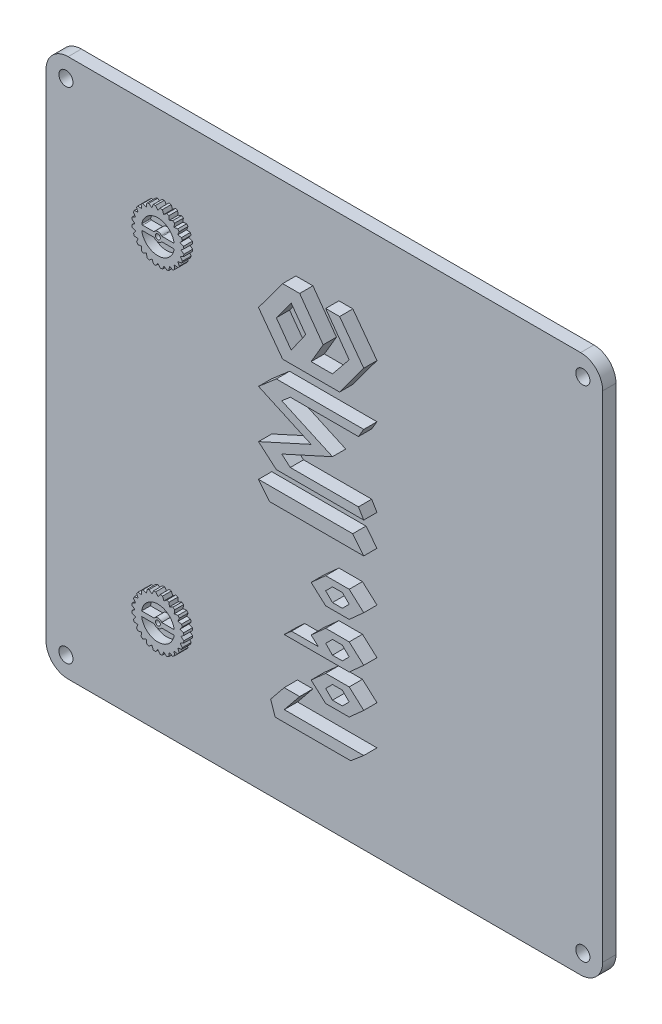
from build123d import *

# Parameters (mm, degrees)
SKETCH1_W                = 126
SKETCH1_H                = 122
BOSS_EXTRUDE1_DEPTH      = 3
RESSALTO_EXTRUS_O3_DEPTH = 3
ESBO_O10_R               = 0.554459351
RESSALTO_EXTRUS_O4_DEPTH = 2
FILETE8_R                = 0.2
FILETE9_R                = 0.2
SKETCH2_R                = 1.6
CUT_EXTRUDE1_DEPTH       = 3
LPATTERN1_COUNT          = 2
LPATTERN1_PITCH          = 113
LPATTERN1_COUNT_DIR2     = 2
LPATTERN1_PITCH_DIR2     = 117
FILLET1_R                = 5
CUT_EXTRUDE2_DEPTH       = 2


with BuildPart() as part:
    # Sketch1 → Boss-Extrude1 (new body)
    with BuildSketch(Plane.XY):
        Rectangle(SKETCH1_W, SKETCH1_H)
    extrude(amount=BOSS_EXTRUDE1_DEPTH)

    # Esboço8 → Ressalto-extrusão3 (add)
    # profile 1 of 8: a face of its own
    with BuildSketch(Plane.XY.offset(3)):
        Polygon((11.907929172, -39.523854918), (8.955209975, -42.023854918), (-8.14458362, -42.023854918), (-9.164277382, -39.013699925), (-6.094843238, -35.222662578), (-2.594843238, -35.222662578), (-6.077327165, -39.523854918), align=None)
    # profile 2 of 8: a face of its own
    with BuildSketch(Plane.XY.offset(3)):
        Polygon((8.616536491, -30.680606308), (11.907929172, -30.680606308), (8.616536491, -27.72682163), (3.291392681, -27.72682163), (0, -30.680606308), (3.291392681, -30.680606308), (4.833551221, -29.138447768), (7.074377951, -29.138447768), align=None)
    # profile 3 of 8: a face of its own
    with BuildSketch(Plane.XY.offset(3)):
        Polygon((8.616536491, -33.634390986), (11.907929172, -30.680606308), (8.616536491, -30.680606308), (7.074377951, -32.222764848), (4.833551221, -32.222764848), (3.291392681, -30.680606308), (0, -30.680606308), (3.291392681, -33.634390986), align=None)
    # profile 4 of 8: a face of its own
    with BuildSketch(Plane.XY.offset(3)):
        Polygon((-4.431630824, -23.327890267), (1.64569634, -23.327890267), (0, -21.850997928), (3.291392681, -18.897213251), (8.616536491, -18.897213251), (11.907929172, -21.850997928), (8.616536491, -24.804782606), (3.291392681, -24.804782606), (-6.077327165, -24.804782606), align=None)
        Polygon((3.291392681, -21.850997928), (4.833551221, -23.393156469), (7.074377951, -23.393156469), (8.616536491, -21.850997928), (7.074377951, -20.308839388), (4.833551221, -20.308839388), align=None, mode=Mode.SUBTRACT)
    # profile 5 of 8: a face of its own
    with BuildSketch(Plane.XY.offset(3)):
        Polygon((3.291392681, -8.586159206), (0, -11.539943884), (3.291392681, -14.493728561), (8.616536491, -14.493728561), (11.907929172, -11.539943884), (8.616536491, -8.586159206), align=None)
        Polygon((4.833551221, -13.082102424), (7.074377951, -13.082102424), (8.616536491, -11.539943884), (7.074377951, -9.997785343), (4.833551221, -9.997785343), (3.291392681, -11.539943884), align=None, mode=Mode.SUBTRACT)
    # profile 6 of 8: a face of its own
    with BuildSketch(Plane.XY.offset(3)):
        Polygon((-11.907929172, 2.701519282), (9.415641061, 2.701519282), (11.907929172, -0.411671336), (-9.409098231, -0.411671336), align=None)
    # profile 7 of 8: a face of its own
    with BuildSketch(Plane.XY.offset(3)):
        Polygon((-7.876504706, 24.396105607), (-11.907929172, 20.921460839), (0, 15.509215469), (-11.907929172, 10.096970098), (-7.876504706, 6.622325331), (11.907929172, 6.622325331), (10.712421474, 8.622325331), (-4.713821815, 8.622325331), (-6.649054262, 10.290282985), (4.833551221, 15.509215469), (-6.649054262, 20.728147953), (-4.713821815, 22.396105607), (10.712421474, 22.396105607), (11.907929172, 24.396105607), align=None)
    # profile 8 of 8: a face of its own
    with BuildSketch(Plane.XY.offset(3)):
        Polygon((2.730300572, 36.388427661), (0, 31.725610755), (4.821452692, 31.725610755), (8.616536491, 36.388427661), (3.291392681, 43.791032685), (6.447947083, 43.791032685), (11.907929172, 36.388427661), (6.447947083, 28.985822638), (-6.447947083, 28.985822638), (-11.907929172, 36.388427661), (-6.447947083, 43.791032685), (-2.594843238, 43.791032685), align=None)
        Polygon((-7.876504706, 36.388427661), (-4.510334397, 31.725610755), (-1.227294144, 36.388427661), (-4.510334397, 40.95225751), align=None, mode=Mode.SUBTRACT)
    extrude(amount=RESSALTO_EXTRUS_O3_DEPTH)

    # Esboço10 → Ressalto-extrusão4 (add)
    with BuildSketch(Plane.XY.offset(3)):
        Polygon((-29.873680548, 38.901444858), (-30.66276966, 39.224397532), (-30.146590041, 39.903012781), (-30.341659693, 40.368382115), (-31.187447548, 40.476099153), (-30.864494874, 41.265188264), (-31.173364136, 41.664212782), (-32.018211689, 41.549353446), (-31.910494651, 42.3951413), (-32.312114592, 42.70062814), (-33.098446879, 42.371019904), (-33.213306215, 43.215867457), (-33.680307101, 43.406998195), (-34.354536876, 42.885103316), (-34.684145112, 43.671435603), (-35.184701604, 43.735184996), (-35.700881222, 43.056569747), (-36.222776102, 43.730799522), (-36.722776102, 43.662823154), (-37.045728775, 42.873734043), (-37.724344024, 43.389913661), (-38.189713359, 43.194844009), (-38.297430396, 42.349056155), (-39.086519507, 42.672008828), (-39.485544025, 42.363139566), (-39.370684689, 41.518292014), (-40.216472543, 41.626009051), (-40.521959383, 41.22438911), (-40.192351147, 40.438056823), (-41.0371987, 40.323197487), (-41.228329439, 39.856196601), (-40.706434559, 39.181966826), (-41.492766846, 38.85235859), (-41.556516239, 38.351802098), (-40.87790099, 37.83562248), (-41.552130765, 37.313727601), (-41.484154397, 36.813727601), (-40.695065286, 36.490774927), (-41.211244904, 35.812159678), (-41.016175252, 35.346790343), (-40.170387398, 35.239073306), (-40.493340071, 34.449984195), (-40.18447081, 34.050959677), (-39.339623257, 34.165819013), (-39.447340295, 33.320031159), (-39.045720353, 33.014544319), (-38.259388066, 33.344152555), (-38.14452873, 32.499305002), (-37.677527844, 32.308174264), (-37.003298069, 32.830069143), (-36.673689833, 32.043736856), (-36.173133341, 31.979987463), (-35.656953723, 32.658602712), (-35.135058844, 31.984372937), (-34.635058844, 32.052349305), (-34.31210617, 32.841438416), (-33.633490921, 32.325258798), (-33.168121587, 32.52032845), (-33.060404549, 33.366116304), (-32.271315438, 33.043163631), (-31.87229092, 33.352032892), (-31.987150256, 34.196880445), (-31.141362402, 34.089163408), (-30.835875562, 34.490783349), (-31.165483798, 35.277115636), (-30.320636245, 35.391974972), (-30.129505507, 35.858975858), (-30.651400386, 36.533205633), (-29.865068099, 36.862813869), (-29.801318706, 37.363370361), (-30.479933955, 37.879549979), (-29.80570418, 38.401444858), align=None)
        with BuildLine():
            Line((-31.996327712, 38.401444858), (-34.824495631, 38.401444858))
            ThreePointArc((-34.824495631, 38.401444858), (-35.678917473, 38.870413407), (-36.533339314, 38.401444858))
            Line((-36.533339314, 38.401444858), (-39.361507234, 38.401444858))
            ThreePointArc((-39.361507234, 38.401444858), (-35.678917473, 41.58011891), (-31.996327712, 38.401444858))
        make_face(mode=Mode.SUBTRACT)
        with BuildLine():
            ThreePointArc((-36.533339314, 37.313727601), (-35.678917473, 36.844759052), (-34.824495631, 37.313727601))
            Line((-34.824495631, 37.313727601), (-31.996327712, 37.313727601))
            ThreePointArc((-31.996327712, 37.313727601), (-35.678917473, 34.135053549), (-39.361507234, 37.313727601))
            Line((-39.361507234, 37.313727601), (-36.533339314, 37.313727601))
        make_face(mode=Mode.SUBTRACT)
        with Locations((-35.678917473, 37.857586229)):
            Circle(ESBO_O10_R, mode=Mode.SUBTRACT)
    ressalto_extrus_o4 = extrude(amount=RESSALTO_EXTRUS_O4_DEPTH)

    # Filete8
    filete8_edges = [part.edges().sort_by_distance(p)[0] for p in [
        (-39.361507234, 38.401444858, 4),
        (-31.996327712, 38.401444858, 4),
        (-39.361507234, 37.313727601, 4),
        (-31.996327712, 37.313727601, 4),
    ]]
    fillet(filete8_edges, radius=FILETE8_R)

    # Filete9
    filete9_edges = [part.edges().sort_by_distance(p)[0] for p in [
        (-34.824495631, 38.401444858, 4),
        (-36.533339314, 37.313727601, 4),
        (-34.824495631, 37.313727601, 4),
        (-36.533339314, 38.401444858, 4),
    ]]
    fillet(filete9_edges, radius=FILETE9_R)

    # Sketch2 → Cut-Extrude1 (cut)
    with BuildSketch(Plane.XY.offset(3)):
        with Locations((-58.5, -56.5)):
            Circle(SKETCH2_R)
    cut_extrude1 = extrude(amount=-CUT_EXTRUDE1_DEPTH, mode=Mode.SUBTRACT)

    # LPattern1: Cut-Extrude1 2 × 2
    with Locations(*[(j * LPATTERN1_PITCH_DIR2, i * LPATTERN1_PITCH, 0) for i in range(LPATTERN1_COUNT) for j in range(LPATTERN1_COUNT_DIR2) if (i, j) != (0, 0)]):
        add(cut_extrude1, mode=Mode.SUBTRACT)

    # Fillet1
    fillet1_edges = [part.edges().sort_by_distance(p)[0] for p in [
        (-63, 61, 1.5),
        (63, 61, 1.5),
        (63, -61, 1.5),
        (-63, -61, 1.5),
    ]]
    fillet(fillet1_edges, radius=FILLET1_R)

    # Mirror1: Ressalto-extrusão4 across plane
    add(ressalto_extrus_o4.mirror(Plane.ZX))

    # Sketch3 → Cut-Extrude2 (cut)
    with BuildSketch(Plane(origin=(0, 0, 0), x_dir=(-1, 0, 0), z_dir=(0, 0, -1))):
        with BuildLine():
            Line((-53.418329696, 46.633705222), (-56.196107474, 46.633705222))
            Line((-56.196107474, 46.633705222), (-56.196107474, 47.605927445))
            Line((-56.196107474, 47.605927445), (-58.834996363, 47.605927445))
            Line((-58.834996363, 47.605927445), (-58.834996363, 50.522594111))
            Line((-58.834996363, 50.522594111), (-52.535083168, 50.522594111))
            add(Edge.make_bspline(
                [(-52.535083168, 50.522594111), (-52.394592355, 50.519232686), (-52.118493509, 50.512626662), (-51.714056273, 50.461448478), (-51.32784645, 50.380168082), (-50.9605981, 50.262294704), (-50.613169102, 50.109481963), (-50.282316499, 49.926417261), (-49.970700174, 49.70858536), (-49.682496439, 49.457240873), (-49.418355854, 49.183708148), (-49.186561329, 48.890018698), (-48.992403169, 48.577336205), (-48.832962338, 48.247862002), (-48.708920895, 47.900758527), (-48.619639748, 47.536597006), (-48.566866004, 47.154646352), (-48.560473105, 46.89428771), (-48.557218585, 46.761743417)],
                knots=[0, 0, 0, 0, 1.100541633, 2.162833772, 3.188943725, 4.189162737, 5.179049965, 6.158447226, 7.147506497, 8.152084341, 9.150261645, 10.123142245, 11.077839049, 12.028489082, 12.985874232, 13.960552905, 14.9617511, 16, 16, 16, 16], degree=3))
            add(Edge.make_bspline(
                [(-48.557218585, 46.761743417), (-48.561456461, 46.615285775), (-48.569820298, 46.326238228), (-48.646734425, 45.903064407), (-48.767395024, 45.497871196), (-48.941611245, 45.113071489), (-49.162592518, 44.746246944), (-49.431526656, 44.397249521), (-49.750531853, 44.066800265), (-49.993084118, 43.870071927), (-50.117548446, 43.769121889)],
                knots=[0, 0, 0, 0, 1.002273698, 1.978078779, 2.935716481, 3.891506896, 4.862685101, 5.86255585, 6.903182576, 8, 8, 8, 8], degree=3))
            Line((-50.117548446, 43.769121889), (-51.855829696, 46.208358))
            add(Edge.make_bspline(
                [(-51.855829696, 46.208358), (-51.814859922, 46.226228326), (-51.735765144, 46.260728138), (-51.62877633, 46.325811707), (-51.537738547, 46.400702343), (-51.462418519, 46.485758614), (-51.406234198, 46.582995126), (-51.364000999, 46.687996626), (-51.340081579, 46.803368086), (-51.336731824, 46.883163134), (-51.334996363, 46.924503833)],
                knots=[0, 0, 0, 0, 1.129705365, 2.180968675, 3.155550737, 4.102251944, 5.037389139, 5.981966108, 6.954484831, 8, 8, 8, 8], degree=3))
            add(Edge.make_bspline(
                [(-51.334996363, 46.924503833), (-51.336662991, 46.978422238), (-51.339813418, 47.080344203), (-51.385852524, 47.221827708), (-51.456557374, 47.342232212), (-51.554571484, 47.444099025), (-51.685468809, 47.517512888), (-51.841953653, 47.567879209), (-52.02446516, 47.601021643), (-52.155145963, 47.604222502), (-52.224753307, 47.605927445)],
                knots=[0, 0, 0, 0, 1.008906688, 1.907136405, 2.76012752, 3.615388814, 4.529008848, 5.54747971, 6.693661033, 8, 8, 8, 8], degree=3))
            Line((-52.224753307, 47.605927445), (-53.418329696, 47.605927445))
            Line((-53.418329696, 47.605927445), (-53.418329696, 46.633705222))
        make_face()
        with BuildLine():
            Line((-51.402270668, 39.272594111), (-54.353659557, 39.272594111))
            add(Edge.make_bspline(
                [(-54.353659557, 39.272594111), (-54.324235867, 39.361499724), (-54.269088883, 39.528129962), (-54.257205861, 39.703121935), (-54.251663029, 39.784746889)],
                knots=[0, 0, 0, 0, 1.067100588, 2, 2, 2, 2], degree=3))
            add(Edge.make_bspline(
                [(-54.251663029, 39.784746889), (-54.254845738, 39.842964411), (-54.260907662, 39.953847998), (-54.311142105, 40.110232735), (-54.40233631, 40.23962966), (-54.525072015, 40.346240268), (-54.683039871, 40.426956738), (-54.87333943, 40.483718239), (-55.097521542, 40.518008996), (-55.257750582, 40.52099884), (-55.34324289, 40.522594111)],
                knots=[0, 0, 0, 0, 0.934586087, 1.780052722, 2.599053896, 3.447631367, 4.368012638, 5.426913624, 6.627095986, 8, 8, 8, 8], degree=3))
            Line((-55.34324289, 40.522594111), (-58.834996363, 40.522594111))
            Line((-58.834996363, 40.522594111), (-58.834996363, 43.300371889))
            Line((-58.834996363, 43.300371889), (-54.811558863, 43.300371889))
            add(Edge.make_bspline(
                [(-54.811558863, 43.300371889), (-54.682672702, 43.298210223), (-54.430716073, 43.293984431), (-54.062916166, 43.251111907), (-53.714082719, 43.185149328), (-53.38526018, 43.090059803), (-53.077458212, 42.965375489), (-52.789608142, 42.815048687), (-52.520562746, 42.639399824), (-52.27645475, 42.434334943), (-52.053972947, 42.210047364), (-51.862791087, 41.962681499), (-51.698404363, 41.699377277), (-51.565575905, 41.416438089), (-51.46099834, 41.116180824), (-51.387657373, 40.797492749), (-51.343716236, 40.460890442), (-51.337950407, 40.230483666), (-51.334996363, 40.112437861)],
                knots=[0, 0, 0, 0, 1.162102176, 2.27176717, 3.335175201, 4.361420639, 5.353772163, 6.325640519, 7.286605365, 8.245685422, 9.196181687, 10.13070968, 11.05959424, 11.990676263, 12.944034937, 13.922169461, 14.935451542, 16, 16, 16, 16], degree=3))
            add(Edge.make_bspline(
                [(-51.334996363, 40.112437861), (-51.335897896, 40.054543252), (-51.337826828, 39.93067115), (-51.352930239, 39.732532997), (-51.370601511, 39.510068856), (-51.391380443, 39.354255695), (-51.402270668, 39.272594111)],
                knots=[0, 0, 0, 0, 0.823982736, 1.763004811, 2.827592166, 4, 4, 4, 4], degree=3))
        make_face()
        with BuildLine():
            Line((-56.074579696, 34.411483), (-58.928312335, 34.411483))
            add(Edge.make_bspline(
                [(-58.928312335, 34.411483), (-58.941874746, 34.518398792), (-58.967653998, 34.721622924), (-58.971881724, 34.926412133), (-58.973885252, 35.023462167)],
                knots=[0, 0, 0, 0, 1.052195826, 2, 2, 2, 2], degree=3))
            add(Edge.make_bspline(
                [(-58.973885252, 35.023462167), (-58.970370776, 35.157418917), (-58.963449875, 35.421213956), (-58.914202388, 35.808385033), (-58.825670146, 36.177711686), (-58.707206294, 36.52999022), (-58.553705048, 36.865245241), (-58.366466574, 37.183291882), (-58.143684615, 37.484218909), (-57.88878466, 37.763535956), (-57.610138583, 38.019859789), (-57.310273346, 38.243328763), (-56.993335559, 38.434746913), (-56.658057631, 38.588288932), (-56.306293905, 38.709005843), (-55.937325607, 38.792301903), (-55.551738996, 38.846603696), (-55.288454431, 38.852782428), (-55.154440807, 38.855927445)],
                knots=[0, 0, 0, 0, 1.062933189, 2.093186797, 3.090086407, 4.072133921, 5.037941973, 6.010600236, 6.995646119, 8.003443106, 9.006997133, 9.99546573, 10.96612323, 11.939543413, 12.916157168, 13.911750344, 14.937066811, 16, 16, 16, 16], degree=3))
            add(Edge.make_bspline(
                [(-55.154440807, 38.855927445), (-55.02332145, 38.852759473), (-54.765801253, 38.846537533), (-54.387222344, 38.79237849), (-54.024085551, 38.706801708), (-53.676241772, 38.583348207), (-53.342447756, 38.428149297), (-53.027151555, 38.23145471), (-52.723701, 38.006547895), (-52.442599013, 37.746133716), (-52.182387665, 37.464953577), (-51.956841896, 37.162307166), (-51.763818228, 36.846041782), (-51.606841041, 36.514318136), (-51.484640996, 36.167399708), (-51.398205393, 35.805240527), (-51.34455397, 35.427992615), (-51.338215107, 35.171211479), (-51.334996363, 35.040823278)],
                knots=[0, 0, 0, 0, 1.046571228, 2.055480094, 3.047445316, 4.021213403, 4.997992339, 5.98078228, 6.983587146, 8.009810282, 9.036033417, 10.038838283, 11.018618818, 11.990174163, 12.963942249, 13.950290763, 14.959199629, 16, 16, 16, 16], degree=3))
            add(Edge.make_bspline(
                [(-51.334996363, 35.040823278), (-51.338632555, 34.896761071), (-51.345742728, 34.615063317), (-51.392298505, 34.204258506), (-51.476355432, 33.817678977), (-51.58742021, 33.453041353), (-51.735942461, 33.112636066), (-51.917953524, 32.796554948), (-52.127782331, 32.500626263), (-52.374484847, 32.235206131), (-52.646209782, 31.994634284), (-52.944425657, 31.786588719), (-53.26611803, 31.608444812), (-53.612805946, 31.466774595), (-53.98211745, 31.352279653), (-54.375534334, 31.273744711), (-54.79294151, 31.224556117), (-55.079064973, 31.21958987), (-55.22605539, 31.217038556)],
                knots=[0, 0, 0, 0, 1.119420693, 2.188903672, 3.206434792, 4.189541444, 5.146050047, 6.085125824, 7.019479886, 7.958286491, 8.894177724, 9.834447025, 10.777819118, 11.745443318, 12.739288686, 13.777672107, 14.858321856, 16, 16, 16, 16], degree=3))
            Line((-55.22605539, 31.217038556), (-58.834996363, 31.217038556))
            Line((-58.834996363, 31.217038556), (-58.834996363, 33.994816333))
            Line((-58.834996363, 33.994816333), (-55.423538029, 33.994816333))
            add(Edge.make_bspline(
                [(-55.423538029, 33.994816333), (-55.328537558, 33.997867793), (-55.147083696, 34.003696175), (-54.88913675, 34.055282634), (-54.662398983, 34.14514092), (-54.46674914, 34.266425997), (-54.307653181, 34.418452433), (-54.194201073, 34.599768534), (-54.123337889, 34.804990392), (-54.11636953, 34.950536447), (-54.11277414, 35.025632306)],
                knots=[0, 0, 0, 0, 1.216071432, 2.322734353, 3.349935302, 4.324247469, 5.254703573, 6.141603491, 7.041142808, 8, 8, 8, 8], degree=3))
            add(Edge.make_bspline(
                [(-54.11277414, 35.025632306), (-54.116391905, 35.094789185), (-54.123535687, 35.231349125), (-54.184859302, 35.428068141), (-54.284495364, 35.609614594), (-54.421372169, 35.769551638), (-54.581309213, 35.906428443), (-54.762855666, 36.006064505), (-54.959574682, 36.06738812), (-55.096134622, 36.074531902), (-55.165291502, 36.078149667)],
                knots=[0, 0, 0, 0, 1.004700143, 1.98392109, 2.968729729, 4, 5.031270271, 6.01607891, 6.995299857, 8, 8, 8, 8], degree=3))
            add(Edge.make_bspline(
                [(-55.165291502, 36.078149667), (-55.237280507, 36.075244754), (-55.376971332, 36.069607927), (-55.57561532, 36.013600288), (-55.753751955, 35.92226307), (-55.909550528, 35.798685713), (-56.038340455, 35.648186572), (-56.12857813, 35.472506812), (-56.188126977, 35.279763712), (-56.193404546, 35.143277388), (-56.196107474, 35.073375361)],
                knots=[0, 0, 0, 0, 1.070552368, 2.077349777, 3.046278711, 4.036085485, 5.022835841, 5.972631328, 6.961674883, 8, 8, 8, 8], degree=3))
            add(Edge.make_bspline(
                [(-56.196107474, 35.073375361), (-56.194128956, 35.014724715), (-56.190256137, 34.899919964), (-56.168873833, 34.730306663), (-56.129597173, 34.567742381), (-56.092819909, 34.463288436), (-56.074579696, 34.411483)],
                knots=[0, 0, 0, 0, 1.040494805, 2.036699621, 3.026272945, 4, 4, 4, 4], degree=3))
        make_face()
        with BuildLine():
            Line((-58.834996363, 23.022594111), (-58.834996363, 25.800371889))
            Line((-58.834996363, 25.800371889), (-54.67918039, 25.800371889))
            add(Edge.make_bspline(
                [(-54.67918039, 25.800371889), (-54.63498906, 25.802271005), (-54.551808254, 25.805845687), (-54.434575753, 25.82594752), (-54.335000233, 25.865424571), (-54.252801318, 25.919649284), (-54.188938194, 25.990681631), (-54.142771662, 26.076675614), (-54.117127309, 26.179442301), (-54.114278123, 26.252342097), (-54.11277414, 26.290823278)],
                knots=[0, 0, 0, 0, 1.238269649, 2.330779947, 3.312517011, 4.217033017, 5.06319088, 5.960419629, 6.923378855, 8, 8, 8, 8], degree=3))
            add(Edge.make_bspline(
                [(-54.11277414, 26.290823278), (-54.114299144, 26.328561924), (-54.117185956, 26.400000705), (-54.142523896, 26.500953664), (-54.190388814, 26.584793569), (-54.251333739, 26.657771911), (-54.335393531, 26.709834427), (-54.435240921, 26.745791898), (-54.551393302, 26.770774125), (-54.63490668, 26.77196355), (-54.67918039, 26.772594111)],
                knots=[0, 0, 0, 0, 1.064162159, 2.014445543, 2.900333988, 3.767940039, 4.667817061, 5.649350358, 6.753828613, 8, 8, 8, 8], degree=3))
            Line((-54.67918039, 26.772594111), (-58.834996363, 26.772594111))
            Line((-58.834996363, 26.772594111), (-58.834996363, 29.550371889))
            Line((-58.834996363, 29.550371889), (-54.729093585, 29.550371889))
            add(Edge.make_bspline(
                [(-54.729093585, 29.550371889), (-54.611771899, 29.547383547), (-54.381372893, 29.541514973), (-54.042693998, 29.497295042), (-53.71833443, 29.424060522), (-53.407875704, 29.319102593), (-53.112250803, 29.184043839), (-52.829947267, 29.020148737), (-52.562881478, 28.826237574), (-52.312491239, 28.605799254), (-52.084336032, 28.364747683), (-51.881923815, 28.10830441), (-51.716133795, 27.834868581), (-51.57376256, 27.551790879), (-51.469117879, 27.252092874), (-51.389517725, 26.940962416), (-51.343581914, 26.615543826), (-51.337887313, 26.394406454), (-51.334996363, 26.282142722)],
                knots=[0, 0, 0, 0, 1.071954041, 2.105127833, 3.115461036, 4.106380371, 5.094473045, 6.080927861, 7.084599286, 8.105753455, 9.125194277, 10.114347895, 11.084902634, 12.042811906, 13.004682226, 13.979527748, 14.974276695, 16, 16, 16, 16], degree=3))
            add(Edge.make_bspline(
                [(-51.334996363, 26.282142722), (-51.338027999, 26.154628079), (-51.343982318, 25.904181538), (-51.399674711, 25.538995676), (-51.489050124, 25.192853777), (-51.611687652, 24.865435751), (-51.7752769, 24.559397638), (-51.970439465, 24.271061308), (-52.20504467, 24.004085704), (-52.383581652, 23.845420056), (-52.474319279, 23.764781611)],
                knots=[0, 0, 0, 0, 1.069529928, 2.100622046, 3.091545134, 4.065664705, 5.026969738, 5.996823943, 6.981928334, 8, 8, 8, 8], degree=3))
            add(Edge.make_bspline(
                [(-52.474319279, 23.764781611), (-52.55134363, 23.705366213), (-52.706503608, 23.585678194), (-52.96255191, 23.432438368), (-53.241988721, 23.308268763), (-53.541587575, 23.20310515), (-53.863219093, 23.120997961), (-54.207262428, 23.063228497), (-54.57282236, 23.027908652), (-54.823773935, 23.024397046), (-54.95261789, 23.022594111)],
                knots=[0, 0, 0, 0, 0.883965838, 1.780685171, 2.704936489, 3.659690965, 4.664661576, 5.718892929, 6.828830396, 8, 8, 8, 8], degree=3))
            Line((-54.95261789, 23.022594111), (-58.834996363, 23.022594111))
        make_face()
    extrude(amount=-CUT_EXTRUDE2_DEPTH, mode=Mode.SUBTRACT)


solid = part.part
